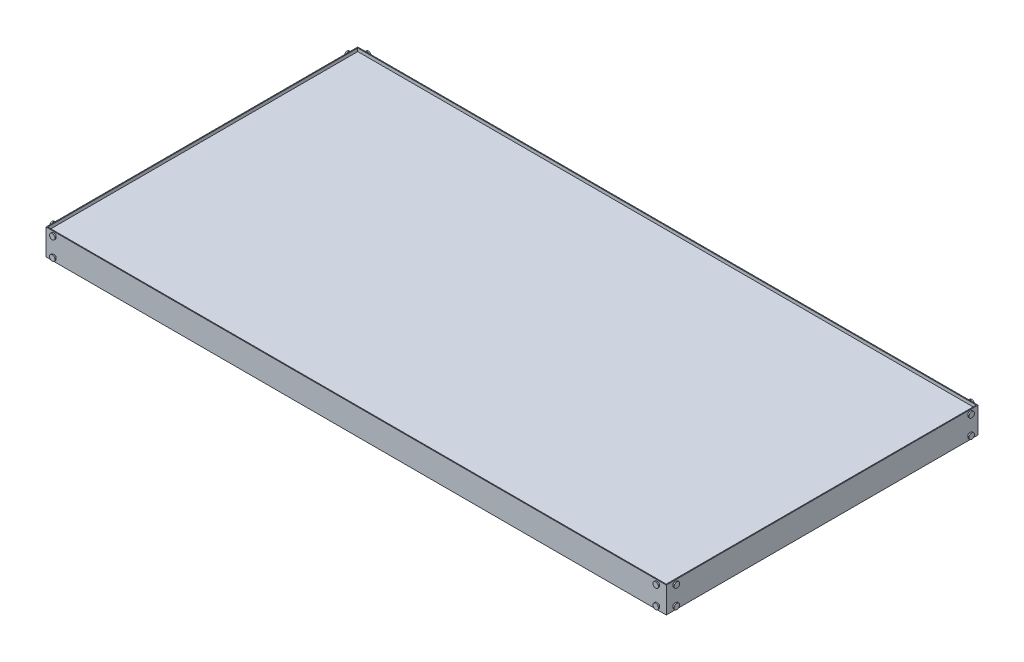
from build123d import *

# Parameters (mm, degrees)
SKETCH2_W               = 1225.55
SKETCH2_H               = 615.95
BOSS_EXTRUDE1_DEPTH     = 51.308
SKETCH3_W               = 1222.248
SKETCH3_H               = 612.648
CUT_EXTRUDE1_DEPTH      = 13.1064
SKETCH4_W               = 1219.2
SKETCH4_H               = 609.6
BOSS_EXTRUDE2_DEPTH     = 8.3312
SKETCH5_R               = 3.556
BOSS_EXTRUDE3_DEPTH     = 2.032
SKETCH6_R               = 5.461
BOSS_EXTRUDE4_DEPTH     = 2.286
SKETCH7_R               = 3.556
BOSS_EXTRUDE5_DEPTH     = 2.032
SKETCH8_R               = 5.461
BOSS_EXTRUDE6_DEPTH     = 2.286
MIRROR3_COPY_1_SKETCH_R = 3.556
MIRROR3_COPY_1_DEPTH    = 2.032
MIRROR3_COPY_2_SKETCH_R = 5.461
MIRROR3_COPY_2_DEPTH    = 2.286
MIRROR3_COPY_3_SKETCH_R = 3.556
MIRROR3_COPY_3_DEPTH    = 2.032
MIRROR3_COPY_4_SKETCH_R = 5.461
MIRROR3_COPY_4_DEPTH    = 2.286


with BuildPart() as part:
    # Sketch2 → Boss-Extrude1 (new body)
    with BuildSketch(Plane(origin=(0, 5.08, 0), x_dir=(1, 0, 0), z_dir=(0, 1, 0))):
        Rectangle(SKETCH2_W, SKETCH2_H)
    extrude(amount=-BOSS_EXTRUDE1_DEPTH)

    # Sketch3 → Cut-Extrude1 (cut)
    with BuildSketch(Plane(origin=(0, 5.08, 0), x_dir=(1, 0, 0), z_dir=(0, 1, 0))):
        Rectangle(SKETCH3_W, SKETCH3_H)
    extrude(amount=-CUT_EXTRUDE1_DEPTH, mode=Mode.SUBTRACT)

    # Sketch5 → Boss-Extrude3 (add)
    with BuildSketch(Plane.XY.offset(307.975)):
        with Locations((596.0872, -0.9652)):
            Circle(SKETCH5_R)
        with Locations((596.0872, -37.5412)):
            Circle(SKETCH5_R)
    boss_extrude3 = extrude(amount=BOSS_EXTRUDE3_DEPTH)

    # Sketch6 → Boss-Extrude4 (add)
    with BuildSketch(Plane.XY.offset(310.007)):
        with Locations((596.0872, -0.9652)):
            Circle(SKETCH6_R)
        with Locations((596.0872, -37.5412)):
            Circle(SKETCH6_R)
    boss_extrude4 = extrude(amount=BOSS_EXTRUDE4_DEPTH)

    # Sketch7 → Boss-Extrude5 (add)
    with BuildSketch(Plane(origin=(612.775, 0, 0), x_dir=(0, 0, -1), z_dir=(1, 0, 0))):
        with Locations((-291.2872, -0.9652)):
            Circle(SKETCH7_R)
        with Locations((-291.2872, -37.5412)):
            Circle(SKETCH7_R)
    boss_extrude5 = extrude(amount=BOSS_EXTRUDE5_DEPTH)

    # Sketch8 → Boss-Extrude6 (add)
    with BuildSketch(Plane(origin=(614.807, 0, 0), x_dir=(0, 0, -1), z_dir=(1, 0, 0))):
        with Locations((-291.2872, -0.9652)):
            Circle(SKETCH8_R)
        with Locations((-291.2872, -37.5412)):
            Circle(SKETCH8_R)
    boss_extrude6 = extrude(amount=BOSS_EXTRUDE6_DEPTH)

    # Mirror2: Boss-Extrude3, Boss-Extrude4, Boss-Extrude5, Boss-Extrude6 across plane
    add(boss_extrude3.mirror(Plane.XY))
    add(boss_extrude4.mirror(Plane.XY))
    add(boss_extrude5.mirror(Plane.XY))
    add(boss_extrude6.mirror(Plane.XY))

    # Mirror3: Boss-Extrude3, Boss-Extrude4, Boss-Extrude5, Boss-Extrude6 across plane
    add(boss_extrude3.mirror(Plane(origin=(0, 0, 0), x_dir=(0, 0, 1), z_dir=(1, 0, 0))))
    add(boss_extrude4.mirror(Plane(origin=(0, 0, 0), x_dir=(0, 0, 1), z_dir=(1, 0, 0))))
    add(boss_extrude5.mirror(Plane(origin=(0, 0, 0), x_dir=(0, 0, 1), z_dir=(1, 0, 0))))
    add(boss_extrude6.mirror(Plane(origin=(0, 0, 0), x_dir=(0, 0, 1), z_dir=(1, 0, 0))))

    # Mirror3 copy 1 sketch → Mirror3 copy 1 (add)
    with BuildSketch(Plane(origin=(0, 0, -307.975), x_dir=(-1, 0, 0), z_dir=(0, 0, -1))):
        with Locations((596.0872, -0.9652)):
            Circle(MIRROR3_COPY_1_SKETCH_R)
        with Locations((596.0872, -37.5412)):
            Circle(MIRROR3_COPY_1_SKETCH_R)
    extrude(amount=MIRROR3_COPY_1_DEPTH)

    # Mirror3 copy 2 sketch → Mirror3 copy 2 (add)
    with BuildSketch(Plane(origin=(0, 0, -310.007), x_dir=(-1, 0, 0), z_dir=(0, 0, -1))):
        with Locations((596.0872, -0.9652)):
            Circle(MIRROR3_COPY_2_SKETCH_R)
        with Locations((596.0872, -37.5412)):
            Circle(MIRROR3_COPY_2_SKETCH_R)
    extrude(amount=MIRROR3_COPY_2_DEPTH)

    # Mirror3 copy 3 sketch → Mirror3 copy 3 (add)
    with BuildSketch(Plane.ZY.offset(612.775)):
        with Locations((-291.2872, -0.9652)):
            Circle(MIRROR3_COPY_3_SKETCH_R)
        with Locations((-291.2872, -37.5412)):
            Circle(MIRROR3_COPY_3_SKETCH_R)
    extrude(amount=MIRROR3_COPY_3_DEPTH)

    # Mirror3 copy 4 sketch → Mirror3 copy 4 (add)
    with BuildSketch(Plane.ZY.offset(614.807)):
        with Locations((-291.2872, -0.9652)):
            Circle(MIRROR3_COPY_4_SKETCH_R)
        with Locations((-291.2872, -37.5412)):
            Circle(MIRROR3_COPY_4_SKETCH_R)
    extrude(amount=MIRROR3_COPY_4_DEPTH)


with BuildPart() as body_2:
    # Sketch4 → Boss-Extrude2 (new body)
    with BuildSketch(Plane(origin=(0, -8.0264, 0), x_dir=(1, 0, 0), z_dir=(0, 1, 0))):
        Rectangle(SKETCH4_W, SKETCH4_H)
    extrude(amount=BOSS_EXTRUDE2_DEPTH)


solid = Compound([part.part, body_2.part])
